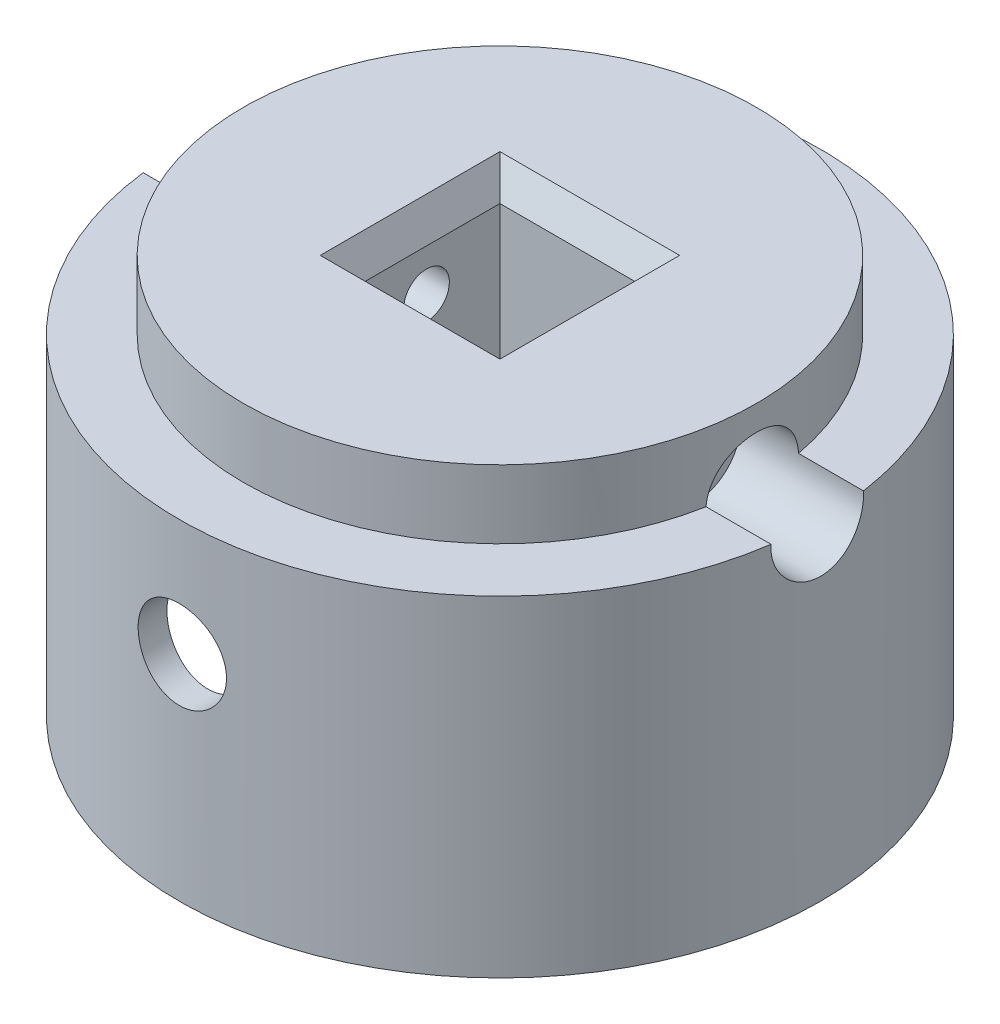
from build123d import *
from OCP.BRepFilletAPI import BRepFilletAPI_MakeChamfer

# Parameters (mm, degrees)
SKETCH1_R                = 22.5
BOSS_EXTRUDE1_DEPTH      = 28
SKETCH2_W                = 10.3
SKETCH2_H                = 10.3
CUT_EXTRUDE2_DEPTH       = 43.385138905
SHELL3_T                 = -2
SKETCH3_R                = 3.1
CUT_EXTRUDE3_DEPTH       = 47.576523056
CHAMFER1_SIZE            = 2
CHAMFER1_SIZE2           = 1.154700538
BOSS_EXTRUDE8_START      = 23
BOSS_EXTRUDE8_DEPTH      = 23
BOSS_EXTRUDE4_DEPTH      = 20
BOSS_EXTRUDE6_DEPTH      = 26
CUT_EXTRUDE5_DEPTH       = 12
SKETCH13_R               = 3.8
CUT_EXTRUDE6_DEPTH       = 16
SKETCH15_W               = 10
SKETCH15_H               = 3
CUT_EXTRUDE8_DEPTH       = 16
CUT_EXTRUDE9_DEPTH       = 2
BOSS_EXTRUDE10_START     = 7
BOSS_EXTRUDE10_DEPTH     = 7
SKETCH21_OUTSIDE_W       = 61.262
SKETCH21_OUTSIDE_H       = 63.966
SKETCH21_OUTSIDE_R       = 18
CUT_EXTRUDE11_DEPTH      = 4.8
CUT_EXTRUDE12_DEPTH      = 47.730672242
CUT_EXTRUDE12_DEPTH_BACK = 47.730672242
SKETCH22_R               = 1.6
CUT_EXTRUDE13_START      = -8.5
SKETCH24_R               = 3.25
CUT_EXTRUDE13_DEPTH      = 39.230672302
CUT_EXTRUDE14_START      = -8.5
CUT_EXTRUDE14_DEPTH      = 39.230672304


with BuildPart() as part:
    # Sketch1 → Boss-Extrude1 (new body)
    with BuildSketch(Plane(origin=(0, 0, 0), x_dir=(1, 0, 0), z_dir=(0, 1, 0))):
        with Locations(Location((0, 0, 0), (0, 0, 270))):
            Circle(SKETCH1_R)
    extrude(amount=BOSS_EXTRUDE1_DEPTH)

    # Sketch2 → Cut-Extrude2 (cut, through all)
    with BuildSketch(Plane.XZ):
        Rectangle(SKETCH2_W, SKETCH2_H)
    extrude(amount=-CUT_EXTRUDE2_DEPTH, mode=Mode.SUBTRACT)

    # Shell3
    shell3_openings = [part.faces().sort_by_distance(p)[0] for p in [
        (0, 0, -21.863603897),
    ]]
    offset(amount=SHELL3_T, openings=shell3_openings, kind=Kind.INTERSECTION)

    # Sketch3 → Cut-Extrude3 (cut, through all)
    with BuildSketch(Plane.XY.offset(7.15)):
        with Locations(Location((0, 15, 0), (0, 0, 270.000000016))):
            Circle(SKETCH3_R)
    extrude(amount=CUT_EXTRUDE3_DEPTH, mode=Mode.SUBTRACT)

    # Chamfer1: one chamfer whose edges measure the first distance from different faces: ONE call of the kernel's chamfer builder (chamfer() names one face for all edges)
    chamfer1_edges_1 = [part.edges().sort_by_distance(p)[0] for p in [
        (5.15, 28, 0),
    ]]
    chamfer1_side_1 = [part.faces().sort_by_distance(p)[0] for p in [
        (5.15, 14, 0),
    ]]
    chamfer1_edges_2 = [part.edges().sort_by_distance(p)[0] for p in [
        (0, 28, -5.15),
    ]]
    chamfer1_side_2 = [part.faces().sort_by_distance(p)[0] for p in [
        (0, 14, -5.15),
    ]]
    chamfer1_edges_3 = [part.edges().sort_by_distance(p)[0] for p in [
        (-5.15, 28, 0),
    ]]
    chamfer1_side_3 = [part.faces().sort_by_distance(p)[0] for p in [
        (-5.15, 14, 0),
    ]]
    chamfer1_edges_4 = [part.edges().sort_by_distance(p)[0] for p in [
        (0, 28, 5.15),
    ]]
    chamfer1_side_4 = [part.faces().sort_by_distance(p)[0] for p in [
        (0, 14, 5.15),
    ]]
    chamfer1 = BRepFilletAPI_MakeChamfer(part.part.solid().wrapped)
    for e in chamfer1_edges_1:
        chamfer1.Add(CHAMFER1_SIZE, CHAMFER1_SIZE2, e.wrapped, chamfer1_side_1[0].wrapped)  # the first distance lies on this face
    for e in chamfer1_edges_2:
        chamfer1.Add(CHAMFER1_SIZE, CHAMFER1_SIZE2, e.wrapped, chamfer1_side_2[0].wrapped)  # the first distance lies on this face
    for e in chamfer1_edges_3:
        chamfer1.Add(CHAMFER1_SIZE, CHAMFER1_SIZE2, e.wrapped, chamfer1_side_3[0].wrapped)  # the first distance lies on this face
    for e in chamfer1_edges_4:
        chamfer1.Add(CHAMFER1_SIZE, CHAMFER1_SIZE2, e.wrapped, chamfer1_side_4[0].wrapped)  # the first distance lies on this face
    add(Compound.cast(chamfer1.Shape()), mode=Mode.REPLACE)

    # Sketch18 → Boss-Extrude8 (add)
    with BuildSketch(Plane.XZ.offset(-26).offset(BOSS_EXTRUDE8_START)):
        with BuildLine():
            Line((-15.72889581, -7.671495069), (-18.425277949, -8.986608509))
            ThreePointArc((-18.425277949, -8.986608509), (-20.471905462, 1.072887103), (-17.384985971, 10.863344917))
            Line((-17.384985971, 10.863344917), (-14.840841683, 9.273587124))
            ThreePointArc((-14.840841683, 9.273587124), (-17.476016858, 0.915879234), (-15.72889581, -7.671495069))
        make_face()
    extrude(amount=-BOSS_EXTRUDE8_DEPTH)

    # Sketch9 → Boss-Extrude4 (add)
    with BuildSketch(Plane.XZ):
        Polygon((2.057061598, -22.405769292), (-16.596699733, -15.192088664), (-17.678751827, -17.990152864), (0.975009504, -25.203833492), align=None)
    extrude(amount=-BOSS_EXTRUDE4_DEPTH)

    # Sketch11 → Boss-Extrude6 (add)
    with BuildSketch(Plane.XZ):
        with BuildLine():
            Line((2.057061598, -22.405769292), (7.15, -7.15))
            Line((7.15, -7.15), (-7.15, -7.15))
            Line((-7.15, -7.15), (-16.596699733, -15.192088664))
            ThreePointArc((-16.596699733, -15.192088664), (-8.115390707, -20.985481497), (2.057061598, -22.405769292))
        make_face()
    extrude(amount=-BOSS_EXTRUDE6_DEPTH)

    # Sketch12 → Cut-Extrude5 (cut)
    with BuildSketch(Plane.XZ):
        with BuildLine():
            Line((3.835926277, -17.077224747), (2.755377072, -20.3139828))
            ThreePointArc((2.755377072, -20.3139828), (-6.94485615, -19.287793369), (-15.072724539, -13.894710323))
            Line((-15.072724539, -13.894710323), (-12.788386178, -11.950025708))
            ThreePointArc((-12.788386178, -11.950025708), (-5.15835992, -16.725347781), (3.835926277, -17.077224747))
        make_face()
    extrude(amount=-CUT_EXTRUDE5_DEPTH, mode=Mode.SUBTRACT)

    # Sketch13 → Cut-Extrude6 (cut)
    with BuildSketch(Plane(origin=(-8.351871161, 0, -21.596993178), x_dir=(-0.9326880665539258, 0, 0.3606840314013081), z_dir=(-0.3606840314013081, 0, -0.9326880665539258))):
        with Locations((0, 10)):
            Circle(SKETCH13_R)
    extrude(amount=-CUT_EXTRUDE6_DEPTH, mode=Mode.SUBTRACT)

    # Sketch15 → Cut-Extrude8 (cut)
    with BuildSketch(Plane(origin=(-8.351871161, 0, -21.596993178), x_dir=(-0.9326880665539258, 0, 0.3606840314013081), z_dir=(-0.3606840314013081, 0, -0.9326880665539258))):
        with Locations((0, 10)):
            Rectangle(SKETCH15_W, SKETCH15_H)
    extrude(amount=-CUT_EXTRUDE8_DEPTH, mode=Mode.SUBTRACT)

    # Sketch17 → Cut-Extrude9 (cut)
    with BuildSketch(Plane.XZ):
        with BuildLine():
            Line((7.15, 7.15), (7.15, -7.15))
            Line((7.15, -7.15), (3.835926277, -17.077224747))
            ThreePointArc((3.835926277, -17.077224747), (-5.15835992, -16.725347781), (-12.788386178, -11.950025708))
            Line((-12.788386178, -11.950025708), (-7.15, -7.15))
            Line((-7.15, -7.15), (-7.15, 7.15))
            Line((-7.15, 7.15), (7.15, 7.15))
        make_face()
    extrude(amount=-CUT_EXTRUDE9_DEPTH, mode=Mode.SUBTRACT)

    # Sketch20 → Boss-Extrude10 (add)
    with BuildSketch(Plane.XZ.offset(-26).offset(BOSS_EXTRUDE10_START)):
        with BuildLine():
            Line((2.755377072, -20.3139828), (7.15, -7.15))
            Line((7.15, -7.15), (7.15, 7.15))
            Line((7.15, 7.15), (-7.15, 7.15))
            Line((-7.15, 7.15), (-7.15, -7.15))
            Line((-7.15, -7.15), (-15.072724539, -13.894710323))
            ThreePointArc((-15.072724539, -13.894710323), (6.94485615, 19.287793369), (2.755377072, -20.3139828))
        make_face()
    extrude(amount=-BOSS_EXTRUDE10_DEPTH)

    # Sketch21 outside → Cut-Extrude11 (cut)
    with BuildSketch(Plane(origin=(0, 28, 0), x_dir=(1, 0, 0), z_dir=(0, 1, 0))):
        with Locations((0, 1.352)):
            Rectangle(SKETCH21_OUTSIDE_W, SKETCH21_OUTSIDE_H)
        with Locations(Location((0, 0, 0), (0, 0, 270))):
            Circle(SKETCH21_OUTSIDE_R, mode=Mode.SUBTRACT)
    extrude(amount=-CUT_EXTRUDE11_DEPTH, mode=Mode.SUBTRACT)

    # Sketch22 → Cut-Extrude12 (cut, two sides: drawn at the far end of the back side and taken through both)
    with BuildSketch(Plane.ZY.offset(-5.15).offset(-CUT_EXTRUDE12_DEPTH_BACK)):
        with Locations((0, 23)):
            Circle(SKETCH22_R)
    extrude(amount=CUT_EXTRUDE12_DEPTH + CUT_EXTRUDE12_DEPTH_BACK, mode=Mode.SUBTRACT)

    # Sketch24 → Cut-Extrude13 (cut, through all)
    with BuildSketch(Plane.ZY.offset(-5.15).offset(CUT_EXTRUDE13_START)):
        with Locations((0, 23)):
            Circle(SKETCH24_R)
    extrude(amount=-CUT_EXTRUDE13_DEPTH, mode=Mode.SUBTRACT)

    # Sketch25 → Cut-Extrude14 (cut, through all)
    with BuildSketch(Plane(origin=(-5.15, 0, 0), x_dir=(0, 0, -1), z_dir=(1, 0, 0)).offset(CUT_EXTRUDE14_START)):
        Polygon((0, 19.893553151), (2.690261887, 21.446776575), (2.690261887, 24.553223425), (0, 26.106446849), (-2.690261887, 24.553223425), (-2.690261887, 21.446776575), align=None)
    extrude(amount=-CUT_EXTRUDE14_DEPTH, mode=Mode.SUBTRACT)


solid = part.part
